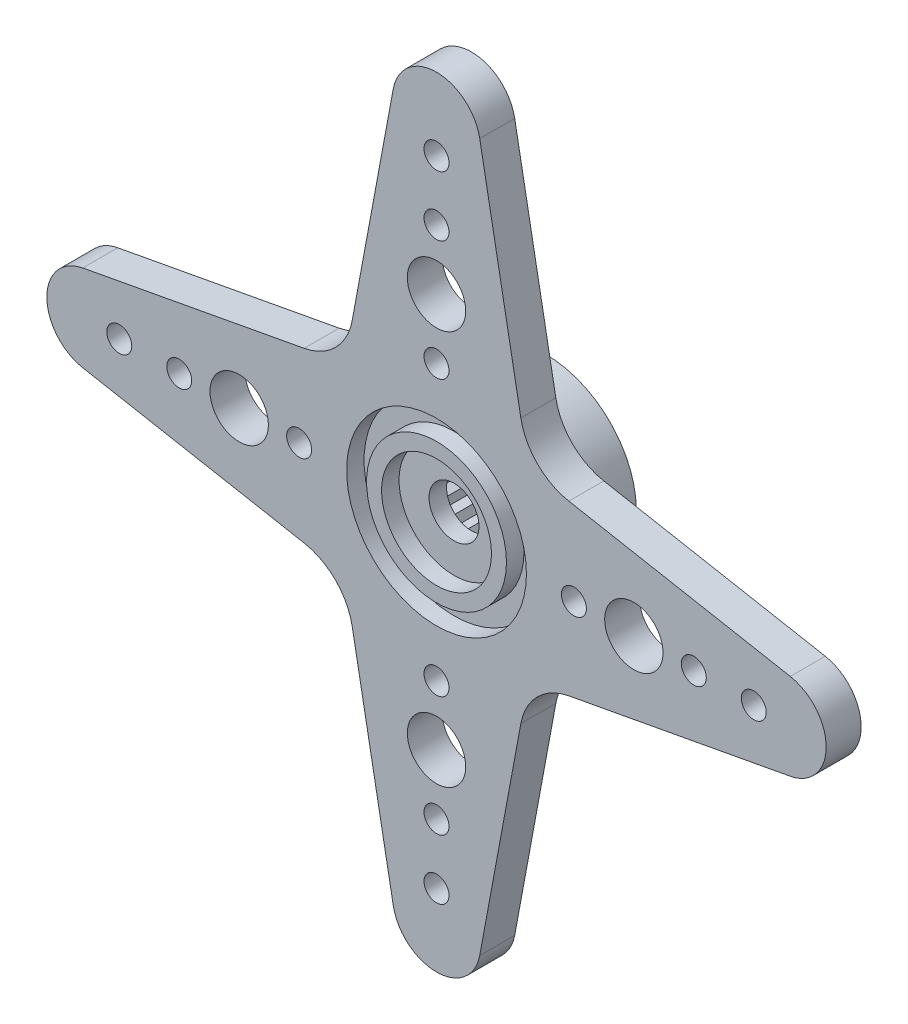
from build123d import *

# Parameters (mm, degrees)
SKETCH1_R           = 4.5000037
BOSS_EXTRUDE1_DEPTH = 3.75000012
BOSS_EXTRUDE2_START = 1.750000056
SKETCH2_R           = 4.5000037
SKETCH2_R_2         = 3.499999998
SKETCH2_R_3         = 1.25000004
BOSS_EXTRUDE2_DEPTH = 1.750000056
SKETCH4_R           = 2.75000466
SKETCH4_R_2         = 1.25000004
CUT_EXTRUDE1_DEPTH  = 0.875000028
SKETCH6_R           = 4.5000037
SKETCH6_R_2         = 3.5000057
CUT_EXTRUDE2_DEPTH  = 0.875000028
SKETCH10_R          = 0.62500002
SKETCH10_R_2        = 4.5000037
BOSS_EXTRUDE4_DEPTH = 1.750000056
CHAMFER2_SIZE       = 1.00000054
CHAMFER2_SIZE2      = 0.577350581
SKETCH32_R          = 1.4605
CUT_EXTRUDE8_DEPTH  = 36.768264294


with BuildPart() as part:
    # Sketch1 → Boss-Extrude1 (new body)
    with BuildSketch(Plane.XY):
        with Locations((-10.24995918, 0)):
            Circle(SKETCH1_R)
        Polygon((-10.24995918, 2.999994), (-10.594624819, 2.728309468), (-10.996027349, 2.905743672), (-11.262299488, 2.55687975), (-11.695217312, 2.628914782), (-11.866365092, 2.224791874), (-12.303596391, 2.186901508), (-12.368865968, 1.752912142), (-12.782937891, 1.60747717), (-12.738228138, 1.170890494), (-13.103123023, 0.927049129), (-12.951243218, 0.515297489), (-13.244033377, 0.188371182), (-12.994526687, -0.172673551), (-13.196815038, -0.562142819), (-12.865358886, -0.849794878), (-12.964434908, -1.27733532), (-12.571855902, -1.473520467), (-12.561494285, -1.912268145), (-12.132459609, -2.004659346), (-12.01331141, -2.427046129), (-11.574778889, -2.409838105), (-11.354330629, -2.789323879), (-10.933854876, -2.663597874), (-10.625958129, -2.976338151), (-10.24995918, -2.749993992), (-9.873960231, -2.976338151), (-9.566063484, -2.663597874), (-9.145587731, -2.789323879), (-8.925139471, -2.409838105), (-8.48660695, -2.427046129), (-8.367458751, -2.004659346), (-7.938424075, -1.912268145), (-7.928062458, -1.473520467), (-7.535483452, -1.27733532), (-7.634559474, -0.849794878), (-7.303103322, -0.562142819), (-7.505391673, -0.172673551), (-7.255884983, 0.188371182), (-7.548675142, 0.515297489), (-7.396795337, 0.927049129), (-7.761690222, 1.170890494), (-7.716980469, 1.60747717), (-8.131052392, 1.752912142), (-8.196321969, 2.186901508), (-8.633553268, 2.224791874), (-8.804701048, 2.628914782), (-9.237618872, 2.55687975), (-9.503891011, 2.905743672), (-9.905293541, 2.728309468), align=None, mode=Mode.SUBTRACT)
    extrude(amount=-BOSS_EXTRUDE1_DEPTH)

    # Sketch2 → Boss-Extrude2 (add)
    # profile 1 of 2: a face of its own
    with BuildSketch(Plane.XY.offset(BOSS_EXTRUDE2_START)):
        with Locations((-10.24995918, 0)):
            Circle(SKETCH2_R)
        with Locations((-10.24995918, 0)):
            Circle(SKETCH2_R_2, mode=Mode.SUBTRACT)
    # profile 2 of 2: a face of its own
    with BuildSketch(Plane.XY.offset(BOSS_EXTRUDE2_START)):
        with Locations((-10.24995918, 0)):
            Circle(SKETCH2_R_2)
        with Locations((-10.24995918, 0)):
            Circle(SKETCH2_R_3, mode=Mode.SUBTRACT)
    extrude(amount=-BOSS_EXTRUDE2_DEPTH)

    # Sketch4 → Cut-Extrude1 (cut)
    with BuildSketch(Plane.XY.offset(1.750000056)):
        with Locations((-10.24995918, 0)):
            Circle(SKETCH4_R)
        with Locations((-10.24995918, 0)):
            Circle(SKETCH4_R_2, mode=Mode.SUBTRACT)
    extrude(amount=-CUT_EXTRUDE1_DEPTH, mode=Mode.SUBTRACT)

    # Sketch6 → Cut-Extrude2 (cut)
    with BuildSketch(Plane.XY.offset(1.750000056)):
        with Locations((-10.24995918, 0)):
            Circle(SKETCH6_R)
        with Locations((-10.24995918, 0)):
            Circle(SKETCH6_R_2, mode=Mode.SUBTRACT)
    extrude(amount=-CUT_EXTRUDE2_DEPTH, mode=Mode.SUBTRACT)

    # Sketch10 → Boss-Extrude4 (add)
    with BuildSketch(Plane.XY.offset(1.750000056)):
        with BuildLine():
            Line((-8.086927824, 17.701557226), (-6.029886341, 6.622035833))
            ThreePointArc((-6.029886341, 6.622035833), (-5.20161423, 5.04834495), (-3.627923347, 4.220072839))
            Line((-3.627923347, 4.220072839), (7.451598046, 2.163031356))
            ThreePointArc((7.451598046, 2.163031356), (9.25000182, 0), (7.451598046, -2.163031356))
            Line((7.451598046, -2.163031356), (-3.627923347, -4.220072839))
            ThreePointArc((-3.627923347, -4.220072839), (-5.20161423, -5.04834495), (-6.029886341, -6.622035833))
            Line((-6.029886341, -6.622035833), (-8.086927824, -17.701557226))
            ThreePointArc((-8.086927824, -17.701557226), (-10.24995918, -19.499961), (-12.412990536, -17.701557226))
            Line((-12.412990536, -17.701557226), (-14.470032019, -6.622035833))
            ThreePointArc((-14.470032019, -6.622035833), (-15.29830413, -5.04834495), (-16.871995013, -4.220072839))
            Line((-16.871995013, -4.220072839), (-27.951516406, -2.163031356))
            ThreePointArc((-27.951516406, -2.163031356), (-29.74992018, 0), (-27.951516406, 2.163031356))
            Line((-27.951516406, 2.163031356), (-16.871995013, 4.220072839))
            ThreePointArc((-16.871995013, 4.220072839), (-15.29830413, 5.04834495), (-14.470032019, 6.622035833))
            Line((-14.470032019, 6.622035833), (-12.412990536, 17.701557226))
            ThreePointArc((-12.412990536, 17.701557226), (-10.24995918, 19.499961), (-8.086927824, 17.701557226))
        make_face()
        with Locations((-10.24995918, 15.87496698)):
            Circle(SKETCH10_R, mode=Mode.SUBTRACT)
        with Locations((-10.24995918, 12.87497298)):
            Circle(SKETCH10_R, mode=Mode.SUBTRACT)
        with Locations((-10.24995918, 9.87497898)):
            Circle(SKETCH10_R, mode=Mode.SUBTRACT)
        with Locations((-10.24995918, 6.87498498)):
            Circle(SKETCH10_R, mode=Mode.SUBTRACT)
        with Locations((5.6250078, 0)):
            Circle(SKETCH10_R, mode=Mode.SUBTRACT)
        with Locations((2.6250138, 0)):
            Circle(SKETCH10_R, mode=Mode.SUBTRACT)
        with Locations((-0.3749802, 0)):
            Circle(SKETCH10_R, mode=Mode.SUBTRACT)
        with Locations((-3.3749742, 0)):
            Circle(SKETCH10_R, mode=Mode.SUBTRACT)
        with Locations((-10.24995918, -15.87496698)):
            Circle(SKETCH10_R, mode=Mode.SUBTRACT)
        with Locations((-10.24995918, -12.87497298)):
            Circle(SKETCH10_R, mode=Mode.SUBTRACT)
        with Locations((-10.24995918, -9.87497898)):
            Circle(SKETCH10_R, mode=Mode.SUBTRACT)
        with Locations((-10.24995918, -6.87498498)):
            Circle(SKETCH10_R, mode=Mode.SUBTRACT)
        with Locations((-26.12492616, 0)):
            Circle(SKETCH10_R, mode=Mode.SUBTRACT)
        with Locations((-23.12493216, 0)):
            Circle(SKETCH10_R, mode=Mode.SUBTRACT)
        with Locations((-20.12493816, 0)):
            Circle(SKETCH10_R, mode=Mode.SUBTRACT)
        with Locations((-17.12494416, 0)):
            Circle(SKETCH10_R, mode=Mode.SUBTRACT)
        with Locations((-10.24995918, 0)):
            Circle(SKETCH10_R_2, mode=Mode.SUBTRACT)
    extrude(amount=-BOSS_EXTRUDE4_DEPTH)

    # Chamfer2
    chamfer2_edges = [part.edges().sort_by_distance(p)[0] for p in [
        (-14.74996288, 0, 0),
    ]]
    chamfer2_side = [part.faces().sort_by_distance(p)[0] for p in [
        (-14.74996288, 0, -1.87500006),
    ]]
    chamfer(chamfer2_edges, length=CHAMFER2_SIZE, length2=CHAMFER2_SIZE2, reference=chamfer2_side[0])

    # Sketch32 → Cut-Extrude8 (cut, through all)
    with BuildSketch(Plane(origin=(0, 0, 0), x_dir=(-1, 0, 0), z_dir=(0, 0, -1))):
        with Locations((20.12493816, 0)):
            Circle(SKETCH32_R)
        with Locations((10.24995918, -9.87497898)):
            Circle(SKETCH32_R)
        with Locations((0.3749802, 0)):
            Circle(SKETCH32_R)
        with Locations((10.24995918, 9.87497898)):
            Circle(SKETCH32_R)
    extrude(amount=-CUT_EXTRUDE8_DEPTH, mode=Mode.SUBTRACT)


solid = part.part
